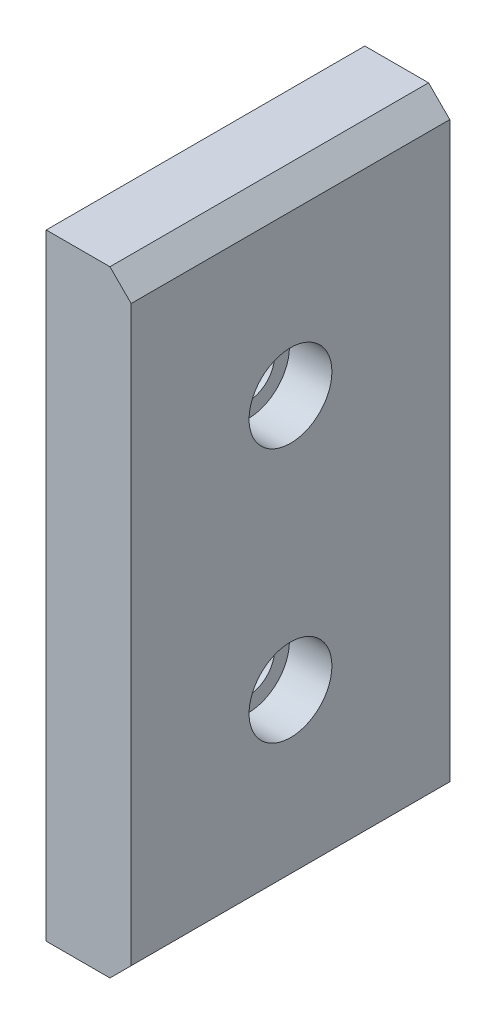
from build123d import *

# Parameters (mm, degrees)
SKETCH_1_W          = 15
SKETCH_1_H          = 29
SKETCH_1_R          = 1.25
EXTRUDE_1_DEPTH     = 4
SKETCH_2_R          = 1.95
CUT_EXTRUDE_1_DEPTH = 2
CHAMFER_1_SIZE      = 1


with BuildPart() as part:
    # Эскиз1 → Бобышка-Вытянуть1 (new body)
    with BuildSketch(Plane(origin=(0, 0, 0), x_dir=(0, 0, -1), z_dir=(1, 0, 0))):
        Rectangle(SKETCH_1_W, SKETCH_1_H)
        with Locations((0, 6)):
            Circle(SKETCH_1_R, mode=Mode.SUBTRACT)
        with Locations(Location((0, -6, 0), (0, 0, 180))):
            Circle(SKETCH_1_R, mode=Mode.SUBTRACT)
    extrude(amount=EXTRUDE_1_DEPTH)

    # Эскиз2 → Вырез-Вытянуть1 (cut)
    with BuildSketch(Plane(origin=(4, 0, 0), x_dir=(0, 0, -1), z_dir=(1, 0, 0))):
        with Locations((0, 6)):
            Circle(SKETCH_2_R)
        with Locations((0, -6)):
            Circle(SKETCH_2_R)
    extrude(amount=-CUT_EXTRUDE_1_DEPTH, mode=Mode.SUBTRACT)

    # Фаска1
    chamfer_1_edges = [part.edges().sort_by_distance(p)[0] for p in [
        (4, -14.5, 0),
        (4, 14.5, 0),
    ]]
    chamfer(chamfer_1_edges, length=CHAMFER_1_SIZE)


solid = part.part
